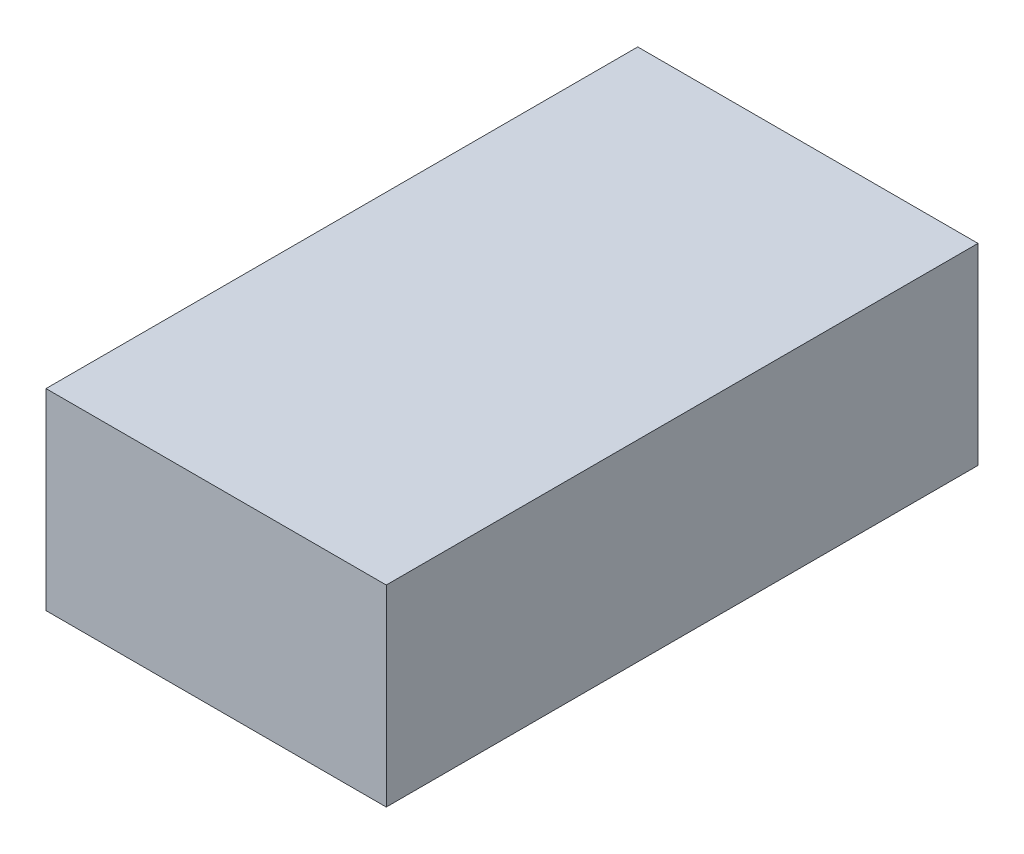
from build123d import *

# Parameters (mm, degrees)
SKETCH1_W           = 23
SKETCH1_H           = 40
BOSS_EXTRUDE1_DEPTH = 13


with BuildPart() as part:
    # Sketch1 → Boss-Extrude1 (new body)
    with BuildSketch(Plane(origin=(0, 0, 0), x_dir=(1, 0, 0), z_dir=(0, 1, 0))):
        Rectangle(SKETCH1_W, SKETCH1_H)
    extrude(amount=BOSS_EXTRUDE1_DEPTH)


solid = part.part
